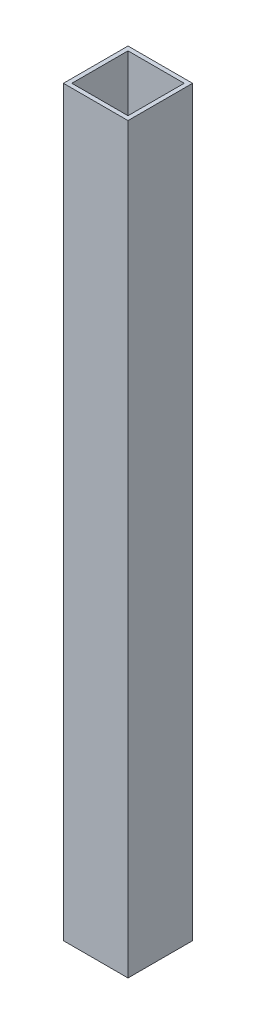
from build123d import *

# Parameters (mm, degrees)
SKETCH1_W           = 25.4
SKETCH1_H           = 25.4
BOSS_EXTRUDE1_DEPTH = 146.05
SKETCH2_W           = 22.098
SKETCH2_H           = 22.098
CUT_EXTRUDE1_DEPTH  = 293.651652994


with BuildPart() as part:
    # Sketch1 → Boss-Extrude1 (new, symmetric)
    with BuildSketch(Plane(origin=(0, 0, 0), x_dir=(1, 0, 0), z_dir=(0, 1, 0))):
        Rectangle(SKETCH1_W, SKETCH1_H)
    extrude(amount=BOSS_EXTRUDE1_DEPTH, both=True)

    # Sketch2 → Cut-Extrude1 (cut, through all)
    with BuildSketch(Plane(origin=(0, 146.05, 0), x_dir=(1, 0, 0), z_dir=(0, 1, 0))):
        Rectangle(SKETCH2_W, SKETCH2_H)
    extrude(amount=-CUT_EXTRUDE1_DEPTH, mode=Mode.SUBTRACT)


solid = part.part
